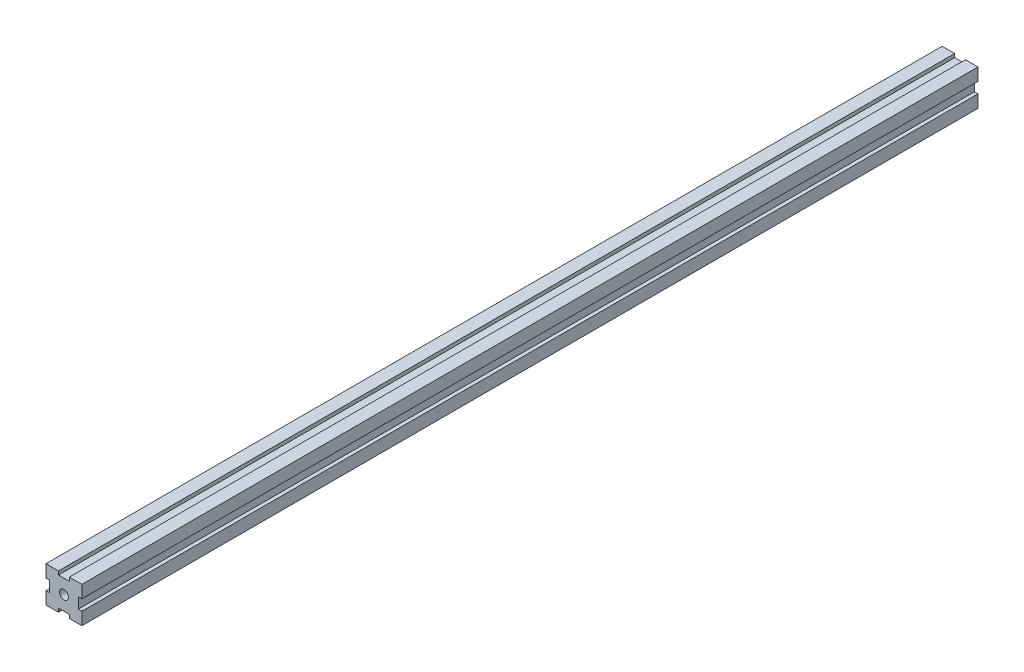
from build123d import *

# Parameters (mm, degrees)
SKETCH_1_R      = 2.5
EXTRUDE_1_DEPTH = 500


with BuildPart() as part:
    # 草图1 → 凸台-拉伸1 (new body)
    with BuildSketch(Plane.XY):
        Polygon((0, -13), (0, -20), (7, -20), (7, -18), (13, -18), (13, -20), (20, -20), (20, -13), (18, -13), (18, -7), (20, -7), (20, 0), (13, 0), (13, -2), (7, -2), (7, 0), (0, 0), (0, -7), (2, -7), (2, -13), align=None)
        with Locations((10, -10)):
            Circle(SKETCH_1_R, mode=Mode.SUBTRACT)
    extrude(amount=EXTRUDE_1_DEPTH)


solid = part.part
